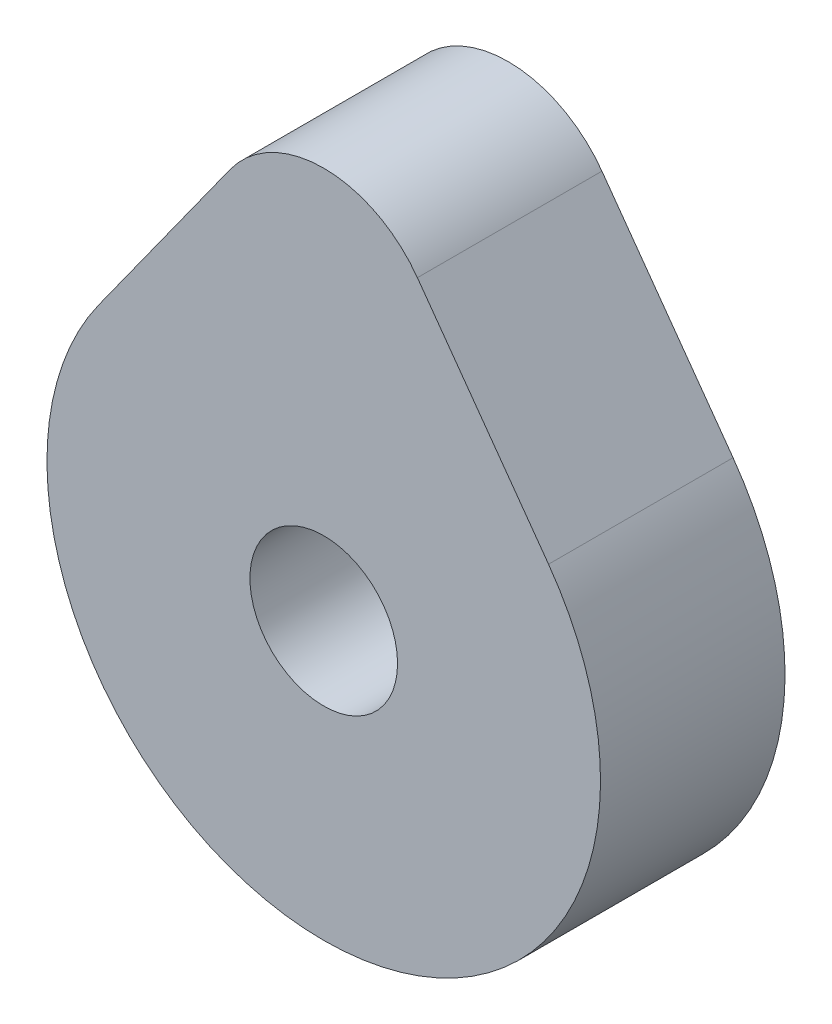
from build123d import *

# Parameters (mm, degrees)
SKETCH1_R           = 4
BOSS_EXTRUDE1_DEPTH = 10


with BuildPart() as part:
    # Sketch1 → Boss-Extrude1 (new body)
    with BuildSketch(Plane.XY):
        with BuildLine():
            Line((-12.183492931, 8.75), (-5.076455388, 18.645833333))
            ThreePointArc((-5.076455388, 18.645833333), (0, 21.25), (5.076455388, 18.645833333))
            Line((5.076455388, 18.645833333), (12.183492931, 8.75))
            ThreePointArc((12.183492931, 8.75), (0, -15), (-12.183492931, 8.75))
        make_face()
        Circle(SKETCH1_R, mode=Mode.SUBTRACT)
    extrude(amount=BOSS_EXTRUDE1_DEPTH)


solid = part.part
